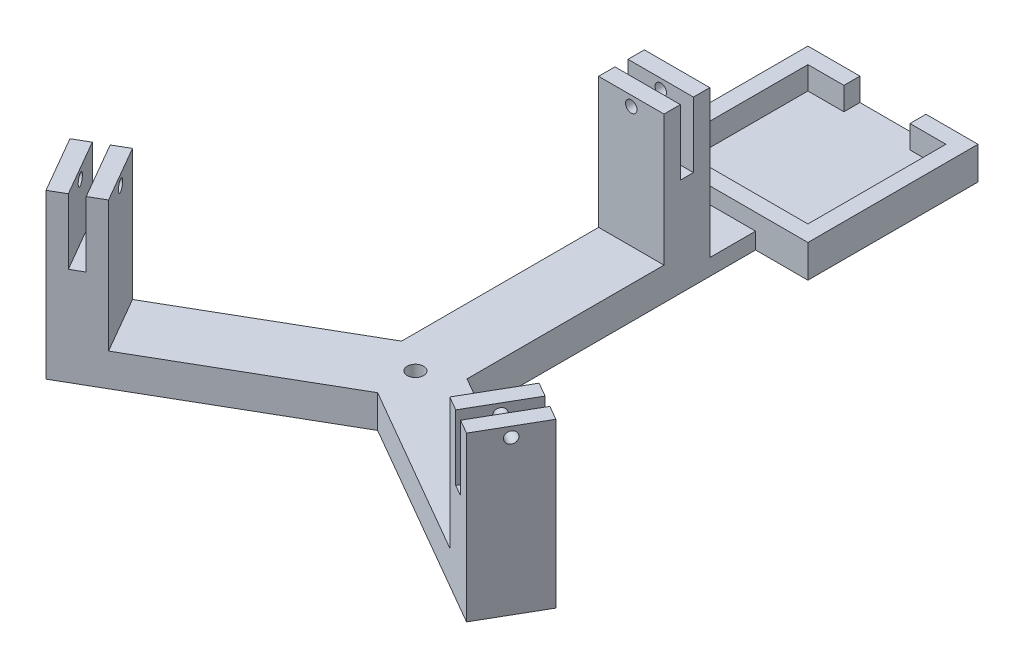
from build123d import *

# Parameters (mm, degrees)
BOSS_EXTRUDE1_DEPTH = 10
SKETCH2_W           = 20
SKETCH2_H           = 14
BOSS_EXTRUDE2_DEPTH = 20
SKETCH3_W           = 20
SKETCH3_H           = 5
BOSS_EXTRUDE3_DEPTH = 20
SKETCH4_R           = 1.75
CUT_EXTRUDE1_DEPTH  = 84.402637848
CIRPATTERN1_COUNT   = 3
SKETCH5_R           = 2.5
CUT_EXTRUDE2_DEPTH  = 117.266161556
SKETCH8_W           = 20
SKETCH8_H           = 14
BOSS_EXTRUDE7_DEPTH = 5
SKETCH11_W          = 52
SKETCH11_H          = 52
BOSS_EXTRUDE8_DEPTH = 10
CUT_EXTRUDE3_DEPTH  = 7


with BuildPart() as part:
    # Sketch1 → Boss-Extrude1 (new body)
    with BuildSketch(Plane(origin=(0, 0, 0), x_dir=(1, 0, 0), z_dir=(0, 1, 0))):
        Polygon((0, 0), (-10, 5.773502692), (-10, 80), (10, 80), (10, 5.773502692), align=None)
    boss_extrude1 = extrude(amount=BOSS_EXTRUDE1_DEPTH)

    # Sketch2 → Boss-Extrude2 (add)
    with BuildSketch(Plane(origin=(0, 10, 0), x_dir=(1, 0, 0), z_dir=(0, 1, 0))):
        with Locations((0, 73)):
            Rectangle(SKETCH2_W, SKETCH2_H)
    boss_extrude2 = extrude(amount=BOSS_EXTRUDE2_DEPTH)

    # Sketch3 → Boss-Extrude3 (add)
    with BuildSketch(Plane(origin=(0, 30, 0), x_dir=(1, 0, 0), z_dir=(0, 1, 0))):
        with Locations((0, 77.5)):
            Rectangle(SKETCH3_W, SKETCH3_H)
        with Locations((0, 68.5)):
            Rectangle(SKETCH3_W, SKETCH3_H)
    boss_extrude3 = extrude(amount=BOSS_EXTRUDE3_DEPTH)

    # Sketch4 → Cut-Extrude1 (cut, symmetric)
    with BuildSketch(Plane.XY.offset(-66)):
        with Locations((0, 47)):
            Circle(SKETCH4_R)
    cut_extrude1 = extrude(amount=CUT_EXTRUDE1_DEPTH, both=True, mode=Mode.SUBTRACT)

    # CirPattern1: Boss-Extrude1, Boss-Extrude2, Boss-Extrude3, Cut-Extrude1 ×3 about axis
    cirpattern1_axis = Axis((0, 0, 0), (0, 1, 0))
    add([boss_extrude1.rotate(cirpattern1_axis, i * 360 / CIRPATTERN1_COUNT) for i in range(1, CIRPATTERN1_COUNT)])
    add([boss_extrude2.rotate(cirpattern1_axis, i * 360 / CIRPATTERN1_COUNT) for i in range(1, CIRPATTERN1_COUNT)])
    add([boss_extrude3.rotate(cirpattern1_axis, i * 360 / CIRPATTERN1_COUNT) for i in range(1, CIRPATTERN1_COUNT)])
    add([cut_extrude1.rotate(cirpattern1_axis, i * 360 / CIRPATTERN1_COUNT) for i in range(1, CIRPATTERN1_COUNT)], mode=Mode.SUBTRACT)

    # Sketch5 → Cut-Extrude2 (cut, through all)
    with BuildSketch(Plane(origin=(0, 10, 0), x_dir=(1, 0, 0), z_dir=(0, 1, 0))):
        with Locations(Location((0, 0, 0), (0, 0, 270))):
            Circle(SKETCH5_R)
    extrude(amount=-CUT_EXTRUDE2_DEPTH, mode=Mode.SUBTRACT)

    # Sketch8 → Boss-Extrude7 (add)
    with BuildSketch(Plane(origin=(0, 0, 0), x_dir=(1, 0, 0), z_dir=(0, 1, 0))):
        with Locations((0, 87)):
            Rectangle(SKETCH8_W, SKETCH8_H)
    extrude(amount=BOSS_EXTRUDE7_DEPTH)

    # Sketch11 → Boss-Extrude8 (add)
    with BuildSketch(Plane(origin=(0, 0, 0), x_dir=(1, 0, 0), z_dir=(0, 1, 0))):
        with Locations((0, 120)):
            Rectangle(SKETCH11_W, SKETCH11_H)
    extrude(amount=BOSS_EXTRUDE8_DEPTH)

    # Sketch12 → Cut-Extrude3 (cut)
    with BuildSketch(Plane(origin=(0, 10, 0), x_dir=(1, 0, 0), z_dir=(0, 1, 0))):
        Polygon((-21.1, 141.1), (-10.1, 141.1), (-10.1, 146), (10.1, 146), (10.1, 141.1), (21.1, 141.1), (21.1, 98.9), (-21.1, 98.9), align=None)
    extrude(amount=-CUT_EXTRUDE3_DEPTH, mode=Mode.SUBTRACT)


solid = part.part
